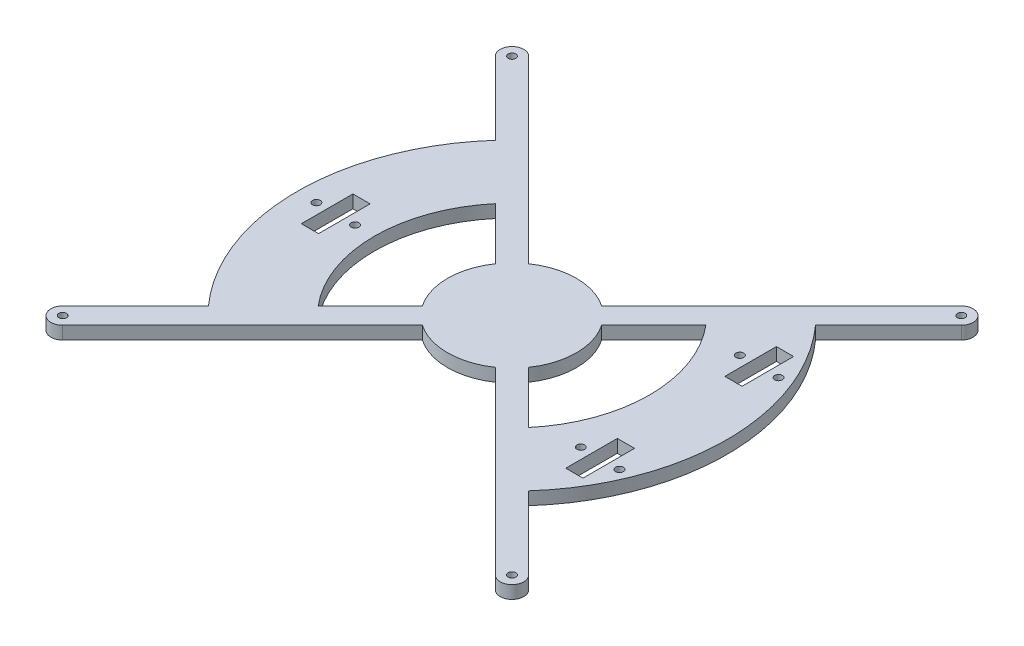
from build123d import *

# Parameters (mm, degrees)
SKETCH1_W           = 220
SKETCH1_H           = 220
SKETCH1_R           = 1.8
SKETCH1_W_2         = 8
SKETCH1_H_2         = 24
BOSS_EXTRUDE1_DEPTH = 3
CUT_EXTRUDE1_DEPTH  = 10


with BuildPart() as part:
    # Sketch1 → Boss-Extrude1 (new, symmetric)
    with BuildSketch(Plane(origin=(0, 0, 0), x_dir=(1, 0, 0), z_dir=(0, 1, 0))):
        Rectangle(SKETCH1_W, SKETCH1_H)
        with Locations(Location((-104.5, 104.5, 0), (0, 0, 270))):
            Circle(SKETCH1_R, mode=Mode.SUBTRACT)
        with Locations(Location((104.5, 104.5, 0), (0, 0, 90))):
            Circle(SKETCH1_R, mode=Mode.SUBTRACT)
        with Locations(Location((104.5, -104.5, 0), (0, 0, 270))):
            Circle(SKETCH1_R, mode=Mode.SUBTRACT)
        with Locations(Location((-104.5, -104.5, 0), (0, 0, 90))):
            Circle(SKETCH1_R, mode=Mode.SUBTRACT)
        with Locations(Location((-73, 0, 0), (0, 0, 270))):
            Circle(SKETCH1_R, mode=Mode.SUBTRACT)
        with Locations(Location((-91, 0, 0), (0, 0, 270))):
            Circle(SKETCH1_R, mode=Mode.SUBTRACT)
        with Locations(Location((87, 37, 0), (0, 0, 270))):
            Circle(SKETCH1_R, mode=Mode.SUBTRACT)
        with Locations(Location((69, 37, 0), (0, 0, 270))):
            Circle(SKETCH1_R, mode=Mode.SUBTRACT)
        with Locations(Location((87, -37, 0), (0, 0, 270))):
            Circle(SKETCH1_R, mode=Mode.SUBTRACT)
        with Locations(Location((69, -37, 0), (0, 0, 270))):
            Circle(SKETCH1_R, mode=Mode.SUBTRACT)
        with Locations((-82, 0)):
            Rectangle(SKETCH1_W_2, SKETCH1_H_2, mode=Mode.SUBTRACT)
        with Locations((78, 37)):
            Rectangle(SKETCH1_W_2, SKETCH1_H_2, mode=Mode.SUBTRACT)
        with Locations((78, -37)):
            Rectangle(SKETCH1_W_2, SKETCH1_H_2, mode=Mode.SUBTRACT)
    extrude(amount=BOSS_EXTRUDE1_DEPTH, both=True)

    # Sketch2 → Cut-Extrude1 (cut)
    with BuildSketch(Plane.XZ.offset(3)):
        with BuildLine():
            ThreePointArc((-108.389087297, 100.610912703), (-109.581337429, 102.395241122), (-110, 104.5))
            Line((-110, 104.5), (-110, -104.50000001))
            ThreePointArc((-110, -104.50000001), (-109.581337431, -102.395241127), (-108.389087297, -100.610912703))
            Line((-108.389087297, -100.610912703), (-74.492734511, -66.714559918))
            ThreePointArc((-74.492734511, -66.714559918), (-100, 0), (-74.492734511, 66.714559918))
            Line((-74.492734511, 66.714559918), (-108.389087297, 100.610912703))
        make_face()
        with BuildLine():
            Line((-24.74274405, 16.964569457), (-48.976502392, 41.198327799))
            ThreePointArc((-48.976502392, 41.198327799), (-64, 0), (-48.976502392, -41.198327799))
            Line((-48.976502392, -41.198327799), (-24.74274405, -16.964569457))
            ThreePointArc((-24.74274405, -16.964569457), (-30, 0), (-24.74274405, 16.964569457))
        make_face()
        with BuildLine():
            ThreePointArc((64, 0), (60.126933038, 21.926055812), (48.976502392, 41.198327799))
            Line((48.976502392, 41.198327799), (24.74274405, 16.964569457))
            ThreePointArc((24.74274405, 16.964569457), (28.65556073, 8.880249954), (30, 0))
            ThreePointArc((30, 0), (28.65556073, -8.880249954), (24.74274405, -16.964569457))
            Line((24.74274405, -16.964569457), (48.976502392, -41.198327799))
            ThreePointArc((48.976502392, -41.198327799), (60.126933038, -21.926055812), (64, 0))
        make_face()
        with BuildLine():
            Line((110, -104.5), (110, 104.5))
            ThreePointArc((110, 104.5), (109.581337429, 102.395241122), (108.389087297, 100.610912703))
            Line((108.389087297, 100.610912703), (74.492734511, 66.714559918))
            ThreePointArc((74.492734511, 66.714559918), (93.405763878, 35.71222864), (100, 0))
            ThreePointArc((100, 0), (93.405763878, -35.71222864), (74.492734511, -66.714559918))
            Line((74.492734511, -66.714559918), (108.389087297, -100.610912703))
            ThreePointArc((108.389087297, -100.610912703), (109.581337429, -102.395241122), (110, -104.5))
        make_face()
        with BuildLine():
            Line((-104.500000026, 110), (-110, 110))
            Line((-110, 110), (-110, 104.5))
            ThreePointArc((-110, 104.5), (-108.389087306, 108.389087287), (-104.500000026, 110))
        make_face()
        with BuildLine():
            ThreePointArc((-104.5, -110), (-108.389087293, -108.3890873), (-110, -104.50000001))
            Line((-110, -104.50000001), (-110, -110))
            Line((-110, -110), (-104.5, -110))
        make_face()
        with BuildLine():
            Line((110, -110), (110, -104.5))
            ThreePointArc((110, -104.5), (108.389087297, -108.389087297), (104.5, -110))
            Line((104.5, -110), (110, -110))
        make_face()
        with BuildLine():
            Line((110, 110), (104.5, 110))
            ThreePointArc((104.5, 110), (108.389087297, 108.389087297), (110, 104.5))
            Line((110, 104.5), (110, 110))
        make_face()
        with BuildLine():
            ThreePointArc((41.198327799, 48.976502392), (0, 64), (-41.198327799, 48.976502392))
            Line((-41.198327799, 48.976502392), (-16.964569457, 24.74274405))
            ThreePointArc((-16.964569457, 24.74274405), (0, 30), (16.964569457, 24.74274405))
            Line((16.964569457, 24.74274405), (41.198327799, 48.976502392))
        make_face()
        with BuildLine():
            ThreePointArc((66.714559918, 74.492734511), (0, 100), (-66.714559918, 74.492734511))
            Line((-66.714559918, 74.492734511), (-41.198327799, 48.976502392))
            ThreePointArc((-41.198327799, 48.976502392), (0, 64), (41.198327799, 48.976502392))
            Line((41.198327799, 48.976502392), (66.714559918, 74.492734511))
        make_face()
        with BuildLine():
            Line((104.5, 110), (-104.500000026, 110))
            ThreePointArc((-104.500000026, 110), (-102.395241134, 109.581337434), (-100.610912703, 108.389087297))
            Line((-100.610912703, 108.389087297), (-66.714559918, 74.492734511))
            ThreePointArc((-66.714559918, 74.492734511), (0, 100), (66.714559918, 74.492734511))
            Line((66.714559918, 74.492734511), (100.610912703, 108.389087297))
            ThreePointArc((100.610912703, 108.389087297), (102.395241122, 109.581337429), (104.5, 110))
        make_face()
        with BuildLine():
            ThreePointArc((-100.610912703, -108.389087297), (-102.395241122, -109.581337429), (-104.5, -110))
            Line((-104.5, -110), (104.5, -110))
            ThreePointArc((104.5, -110), (102.395241122, -109.581337429), (100.610912703, -108.389087297))
            Line((100.610912703, -108.389087297), (66.714559918, -74.492734511))
            ThreePointArc((66.714559918, -74.492734511), (0, -100), (-66.714559918, -74.492734511))
            Line((-66.714559918, -74.492734511), (-100.610912703, -108.389087297))
        make_face()
        with BuildLine():
            Line((-41.198327799, -48.976502392), (-66.714559918, -74.492734511))
            ThreePointArc((-66.714559918, -74.492734511), (0, -100), (66.714559918, -74.492734511))
            Line((66.714559918, -74.492734511), (41.198327799, -48.976502392))
            ThreePointArc((41.198327799, -48.976502392), (0, -64), (-41.198327799, -48.976502392))
        make_face()
        with BuildLine():
            Line((-16.964569457, -24.74274405), (-41.198327799, -48.976502392))
            ThreePointArc((-41.198327799, -48.976502392), (0, -64), (41.198327799, -48.976502392))
            Line((41.198327799, -48.976502392), (16.964569457, -24.74274405))
            ThreePointArc((16.964569457, -24.74274405), (0, -30), (-16.964569457, -24.74274405))
        make_face()
    extrude(amount=-CUT_EXTRUDE1_DEPTH, mode=Mode.SUBTRACT)


solid = part.part
